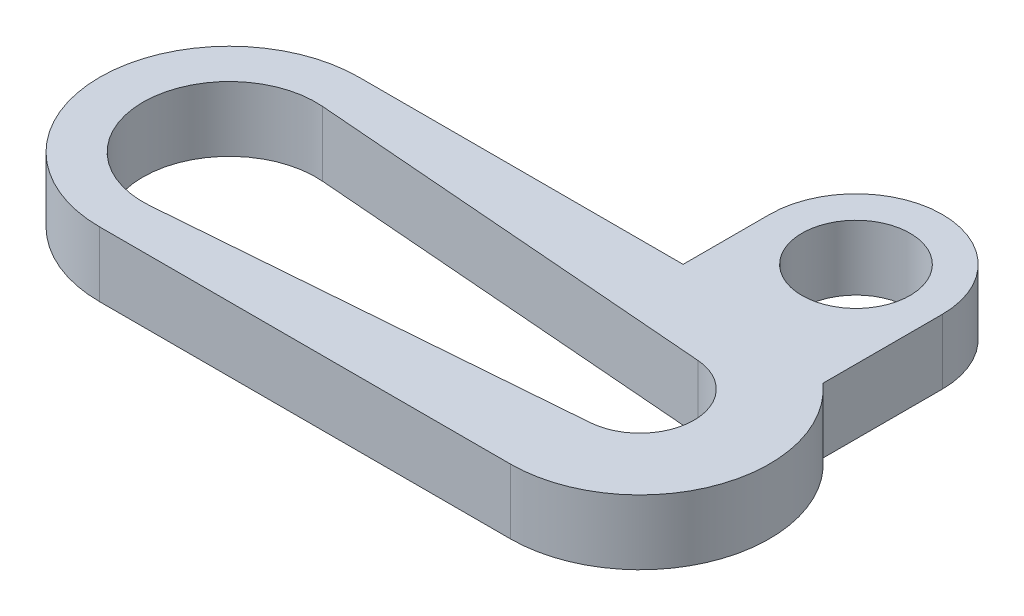
from build123d import *

# Parameters (mm, degrees)
SKETCH_1_R      = 2.5
EXTRUDE_1_DEPTH = 3


with BuildPart() as part:
    # 草图1 → 凸台-拉伸1 (new body)
    with BuildSketch(Plane(origin=(0, 0, 0), x_dir=(1, 0, 0), z_dir=(0, 1, 0))):
        with BuildLine():
            ThreePointArc((19, -6), (24.605034154, -2.140932539), (23, 4.472135955))
            Line((23, 4.472135955), (23, 10))
            ThreePointArc((23, 10), (19, 14), (15, 10))
            Line((15, 10), (15, 6))
            Line((15, 6), (0, 6))
            ThreePointArc((0, 6), (-6, 0), (0, -6))
            Line((0, -6), (19, -6))
        make_face()
        with BuildLine():
            ThreePointArc((0.315789474, -3.987515142), (-4, 0), (0.315789474, 3.987515142))
            Line((0.315789474, 3.987515142), (19.197368421, 2.492196964))
            ThreePointArc((19.197368421, 2.492196964), (21.5, 0), (19.197368421, -2.492196964))
            Line((19.197368421, -2.492196964), (0.315789474, -3.987515142))
        make_face(mode=Mode.SUBTRACT)
        with Locations(Location((19, 10, 0), (0, 0, 270))):
            Circle(SKETCH_1_R, mode=Mode.SUBTRACT)
    extrude(amount=EXTRUDE_1_DEPTH)


solid = part.part
